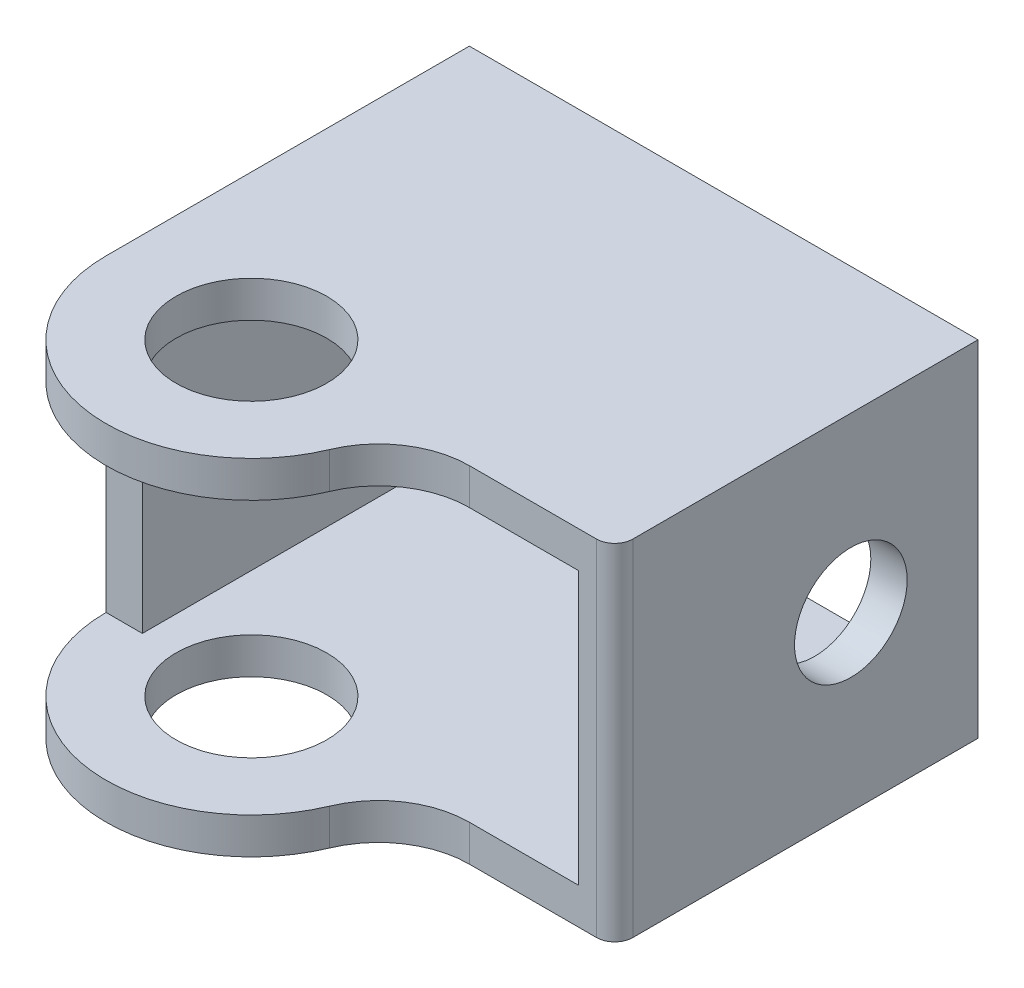
from build123d import *

# Parameters (mm, degrees)
BOSS_EXTRUDE1_DEPTH = 19
SKETCH2_W           = 24
SKETCH2_H           = 15
CUT_EXTRUDE1_DEPTH  = 38.59555024
SKETCH3_W           = 5.291502622
SKETCH3_H           = 15
CUT_EXTRUDE2_DEPTH  = 39.990548382
SKETCH4_R           = 3.1
CUT_EXTRUDE4_DEPTH  = 9


with BuildPart() as part:
    # Sketch1 → Boss-Extrude1 (new body)
    with BuildSketch(Plane(origin=(0, 0, 0), x_dir=(1, 0, 0), z_dir=(0, 1, 0))):
        with BuildLine():
            Line((16.383693046, 8.628297362), (-11.616306954, 8.628297362))
            Line((-11.616306954, 8.628297362), (-11.616306954, -11.371702638))
            ThreePointArc((-11.616306954, -11.371702638), (-5.185236036, -19.216348043), (3.76830843, -14.448625715))
            ThreePointArc((3.76830843, -14.448625715), (5.610192064, -12.211451166), (8.383693046, -11.371702638))
            Line((8.383693046, -11.371702638), (15.383693046, -11.371702638))
            ThreePointArc((15.383693046, -11.371702638), (16.090799827, -11.078809419), (16.383693046, -10.371702638))
            Line((16.383693046, -10.371702638), (16.383693046, 8.628297362))
        make_face()
        with BuildLine():
            ThreePointArc((-7.766306954, -11.371702638), (-3.616306954, -15.521702638), (0.533693046, -11.371702638))
            ThreePointArc((0.533693046, -11.371702638), (-3.616306954, -7.221702638), (-7.766306954, -11.371702638))
        make_face(mode=Mode.SUBTRACT)
    extrude(amount=BOSS_EXTRUDE1_DEPTH)

    # Sketch2 → Cut-Extrude1 (cut, through all)
    with BuildSketch(Plane(origin=(0, 0, -8.628297362), x_dir=(-1, 0, 0), z_dir=(0, 0, -1))):
        with Locations((-2.383693046, 9.5)):
            Rectangle(SKETCH2_W, SKETCH2_H)
    extrude(amount=-CUT_EXTRUDE1_DEPTH, mode=Mode.SUBTRACT)

    # Sketch3 → Cut-Extrude2 (cut, through all)
    with BuildSketch(Plane.ZY.offset(11.616306954)):
        with Locations((14.017453949, 9.5)):
            Rectangle(SKETCH3_W, SKETCH3_H)
    extrude(amount=-CUT_EXTRUDE2_DEPTH, mode=Mode.SUBTRACT)

    # Sketch4 → Cut-Extrude4 (cut)
    with BuildSketch(Plane(origin=(16.383693046, 0, 0), x_dir=(0, 0, -1), z_dir=(1, 0, 0))):
        with Locations((1.628297362, 9.5)):
            Circle(SKETCH4_R)
    extrude(amount=-CUT_EXTRUDE4_DEPTH, mode=Mode.SUBTRACT)


solid = part.part
